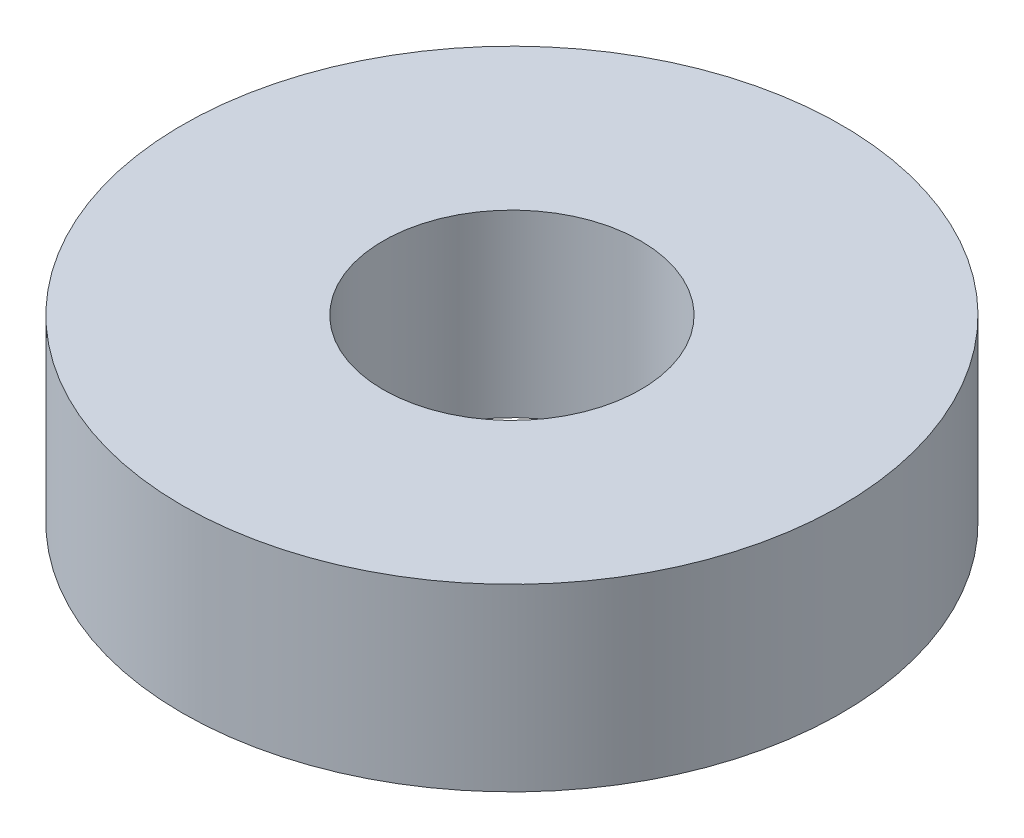
from build123d import *

# Parameters (mm, degrees)
SKETCH1_R            = 5.5
BOSS_EXTRUDE1_DEPTH  = 3
M4_CLEARANCE_HOLE1_D = 4.3
SKETCH5_W            = 3.254
SKETCH5_H            = 1.254
CUT_EXTRUDE2_DEPTH   = 2


with BuildPart() as part:
    # Sketch1 → Boss-Extrude1 (new body)
    with BuildSketch(Plane(origin=(0, 0, 0), x_dir=(1, 0, 0), z_dir=(0, 1, 0))):
        with Locations(Location((0, 0, 0), (0, 0, 270))):
            Circle(SKETCH1_R)
    extrude(amount=BOSS_EXTRUDE1_DEPTH)

    # M4 Clearance Hole1 (through all)
    with Locations(Plane(origin=(0, 3, 0), x_dir=(1, 0, 0), z_dir=(0, 1, 0))):
        with Locations((0, 0)):
            Hole(M4_CLEARANCE_HOLE1_D / 2)

    # Sketch5 → Cut-Extrude2 (cut)
    with BuildSketch(Plane.XZ):
        with Locations((0, 4.05)):
            Rectangle(SKETCH5_W, SKETCH5_H)
        with Locations((0, -4.05)):
            Rectangle(SKETCH5_W, SKETCH5_H)
    extrude(amount=-CUT_EXTRUDE2_DEPTH, mode=Mode.SUBTRACT)


solid = part.part
